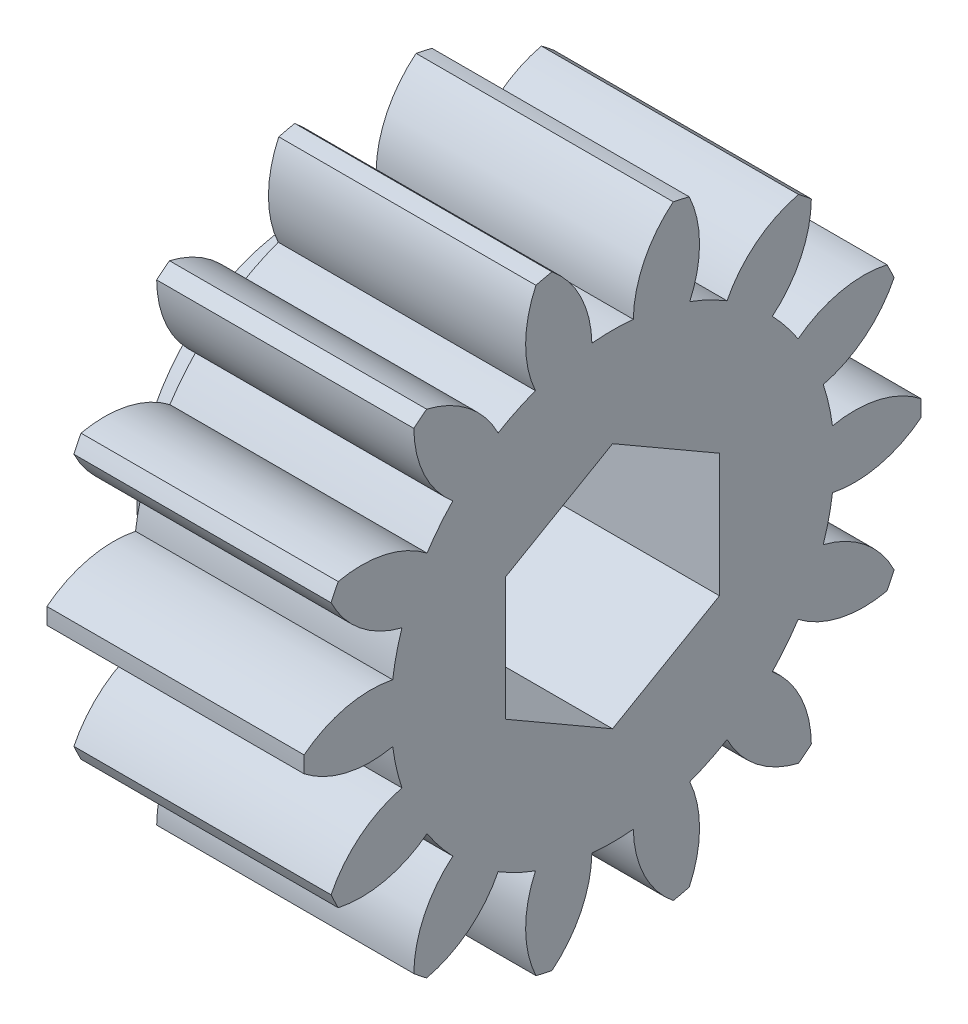
from build123d import *

# Parameters (mm, degrees)
BASPROSKE_W              = 15
BASPROSKE_H              = 12
TOOTHCUT_DEPTH           = 23.649503306
TEETHCUTS_COUNT          = 14
TEETHCUTS_ANGLE          = 334.285714286
BORSKE_R                 = 4
BORE_DEPTH               = 50.0000508
ESBO_O3_R                = 4
ESBO_O3_R_2              = 3
RESSALTO_EXTRUS_O2_DEPTH = 15
ESBO_O4_R                = 14.250212497
CORTE_EXTRUS_O2_DEPTH    = 5
CORTE_EXTRUS_O3_DEPTH    = 20.555988541
ESBO_O7_R                = 6.5
RESSALTO_EXTRUS_O4_DEPTH = 2


with BuildPart() as part:
    # BasProSke → Base-Revolve (revolve)
    with BuildSketch(Plane(origin=(0, 0, 0), x_dir=(1, 0, 0), z_dir=(0, 1, 0)), mode=Mode.PRIVATE) as base_revolve_sk:
        with Locations((7.5, 6)):
            Rectangle(BASPROSKE_W, BASPROSKE_H)
    revolve(base_revolve_sk.sketch.rotate(Axis((-10, 0, 0), (1, 0, 0)), 180), axis=Axis((-10, 0, 0), (1, 0, 0)))

    # TooCutSke → ToothCut (cut, through all)
    with BuildSketch(Plane(origin=(0, 0, 0), x_dir=(0, 0, -1), z_dir=(1, 0, 0))):
        with BuildLine():
            ThreePointArc((0.804845511, 8.586361261), (0, 8.624), (-0.804845511, 8.586361261))
            ThreePointArc((-0.804845511, 8.586361261), (-1.237812142, 10.362618414), (-2.384428228, 11.78663426))
            ThreePointArc((-2.384428228, 11.78663426), (0, 12.0254), (2.384428228, 11.78663426))
            ThreePointArc((2.384428228, 11.78663426), (1.237812142, 10.362618414), (0.804845511, 8.586361261))
        make_face()
    toothcut = extrude(amount=TOOTHCUT_DEPTH, mode=Mode.SUBTRACT)

    # TeethCuts: ToothCut ×14 about axis
    teethcuts_axis = Axis((-10, 0, 0), (1, 0, 0))
    for i in range(1, TEETHCUTS_COUNT):
        add(toothcut.rotate(teethcuts_axis, i * TEETHCUTS_ANGLE / (TEETHCUTS_COUNT - 1)), mode=Mode.SUBTRACT)

    # BorSke → Bore (cut, symmetric)
    with BuildSketch(Plane(origin=(0, 0, 0), x_dir=(0, 0, -1), z_dir=(1, 0, 0))):
        with Locations(Location((0, 0, 0), (0, 0, 180))):
            Circle(BORSKE_R)
    extrude(amount=BORE_DEPTH, both=True, mode=Mode.SUBTRACT)

    # Esboço3 → Ressalto-extrusão2 (add)
    with BuildSketch(Plane(origin=(15, 0, 0), x_dir=(0, 0, -1), z_dir=(1, 0, 0))):
        Circle(ESBO_O3_R)
        Circle(ESBO_O3_R_2, mode=Mode.SUBTRACT)
    extrude(amount=-RESSALTO_EXTRUS_O2_DEPTH)

    # Esboço4 → Corte-extrusão2 (cut)
    with BuildSketch(Plane(origin=(15, 0, 0), x_dir=(0, 0, -1), z_dir=(1, 0, 0))):
        Circle(ESBO_O4_R)
    extrude(amount=-CORTE_EXTRUS_O2_DEPTH, mode=Mode.SUBTRACT)

    # Esboço5 → Corte-extrusão3 (cut, through all)
    with BuildSketch(Plane.ZY):
        Polygon((4.156921938, 2.4), (0, 4.8), (-4.156921938, 2.4), (-4.156921938, -2.4), (0, -4.8), (4.156921938, -2.4), align=None)
    extrude(amount=-CORTE_EXTRUS_O3_DEPTH, mode=Mode.SUBTRACT)

    # Esboço7 → Ressalto-extrusão4 (add)
    with BuildSketch(Plane.ZY):
        with Locations(Location((0, 0, 0), (0, 0, 180))):
            Circle(ESBO_O7_R)
        Polygon((0, 4.8), (-4.156921938, 2.4), (-4.156921938, -2.4), (0, -4.8), (4.156921938, -2.4), (4.156921938, 2.4), align=None, mode=Mode.SUBTRACT)
    extrude(amount=RESSALTO_EXTRUS_O4_DEPTH)


solid = part.part
